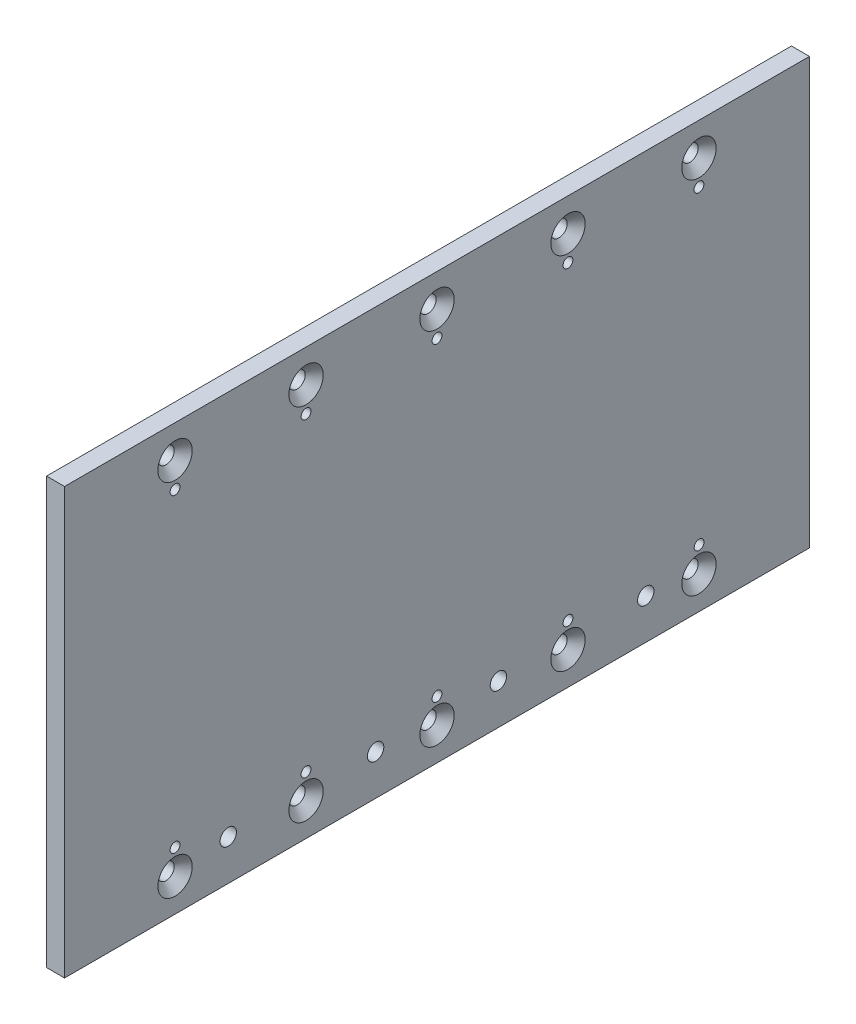
from build123d import *

# Parameters (mm, degrees)
SKETCH1_W                                            = 227.5
SKETCH1_H                                            = 130
BOSS_EXTRUDE1_DEPTH                                  = 5.5
CSK_FOR_M5_HEX_SOCKET_COUNTERSUNK_CAP_SC_D           = 5
CSK_FOR_M5_HEX_SOCKET_COUNTERSUNK_CAP_SC_CSINK_D     = 10.5
CSK_FOR_M5_HEX_SOCKET_COUNTERSUNK_CAP_SC_CSINK_ANGLE = 90
TAP_DRILL_FOR_M5X0_8_TAP1_D                          = 5
SKETCH9_R                                            = 1.5
CUT_EXTRUDE1_DEPTH                                   = 29
SKETCH10_R                                           = 1.5
CUT_EXTRUDE2_DEPTH                                   = 29


with BuildPart() as part:
    # Sketch1 → Boss-Extrude1 (new body)
    with BuildSketch(Plane(origin=(0, 0, 0), x_dir=(0, 0, -1), z_dir=(1, 0, 0))):
        Rectangle(SKETCH1_W, SKETCH1_H)
    extrude(amount=BOSS_EXTRUDE1_DEPTH)

    # CSK for M5 Hex Socket Countersunk Cap Screw1 (through all)
    with Locations(Plane(origin=(5.5, 0, 0), x_dir=(0, 0, -1), z_dir=(1, 0, 0))):
        with Locations((80, 55), (40, 55), (0, 55), (-40, 55), (-80, 55), (-80, -55), (-40, -55), (0, -55), (40, -55), (80, -55)):
            CounterSinkHole(CSK_FOR_M5_HEX_SOCKET_COUNTERSUNK_CAP_SC_D / 2, CSK_FOR_M5_HEX_SOCKET_COUNTERSUNK_CAP_SC_CSINK_D / 2, counter_sink_angle=CSK_FOR_M5_HEX_SOCKET_COUNTERSUNK_CAP_SC_CSINK_ANGLE)

    # Tap Drill for M5x0.8 Tap1 (through all)
    with Locations(Plane(origin=(5.5, 0, 0), x_dir=(0, 0, -1), z_dir=(1, 0, 0))):
        with Locations((-63.75, -52.653836842), (-18.75, -52.653836842), (18.75, -52.653836842), (63.75, -52.653836842)):
            Hole(TAP_DRILL_FOR_M5X0_8_TAP1_D / 2)

    # Sketch9 → Cut-Extrude1 (cut)
    with BuildSketch(Plane.ZY):
        with Locations((-80.045792536, -47.3325)):
            Circle(SKETCH9_R)
        with Locations((-40, -47.3325)):
            Circle(SKETCH9_R)
        with Locations((0, -47.3325)):
            Circle(SKETCH9_R)
        with Locations((40, -47.3325)):
            Circle(SKETCH9_R)
        with Locations((80, -47.3325)):
            Circle(SKETCH9_R)
    extrude(amount=-CUT_EXTRUDE1_DEPTH, mode=Mode.SUBTRACT)

    # Sketch10 → Cut-Extrude2 (cut)
    with BuildSketch(Plane.ZY):
        with Locations((-80, 47.3325)):
            Circle(SKETCH10_R)
        with Locations((-40, 47.3325)):
            Circle(SKETCH10_R)
        with Locations((0, 47.3325)):
            Circle(SKETCH10_R)
        with Locations((40, 47.3325)):
            Circle(SKETCH10_R)
        with Locations((80, 47.3325)):
            Circle(SKETCH10_R)
    extrude(amount=-CUT_EXTRUDE2_DEPTH, mode=Mode.SUBTRACT)


solid = part.part
